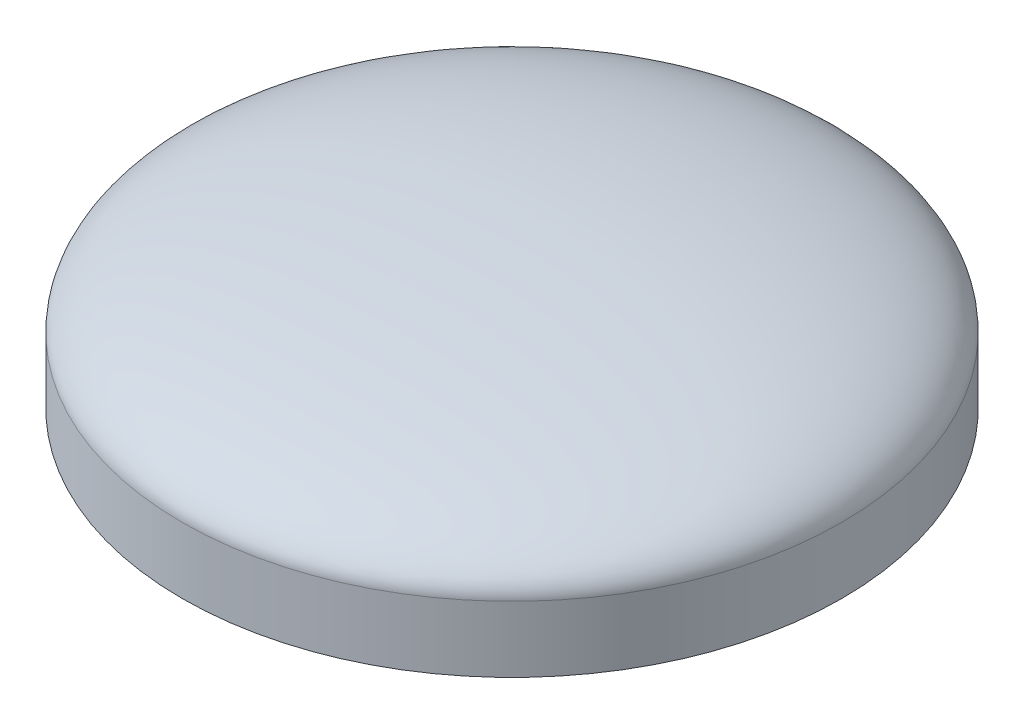
from build123d import *

# Parameters (mm, degrees)
SKETCH1_R           = 100
BOSS_EXTRUDE1_DEPTH = 20
SHELL1_T            = -2


with BuildPart() as part:
    # Sketch1 → Boss-Extrude1 (new body)
    with BuildSketch(Plane(origin=(0, 0, 0), x_dir=(1, 0, 0), z_dir=(0, 1, 0))):
        Circle(SKETCH1_R)
    extrude(amount=BOSS_EXTRUDE1_DEPTH)

    # Sketch2 → Revolve1 (revolve)
    with BuildSketch(Plane.XY):
        with BuildLine():
            Line((0, 20), (0, 45))
            add(Edge.make_bspline(
                [(0, 45), (-100, 45), (-100, 20)],
                knots=[4.71238898, 4.71238898, 4.71238898, 6.283185307, 6.283185307, 6.283185307], degree=2, weights=[1, 0.707106781, 1]))
            Line((-100, 20), (0, 20))
        make_face()
    revolve(axis=Axis((0, 20, 0), (0, 1, 0)))

    # Shell1
    shell1_openings = [part.faces().sort_by_distance(p)[0] for p in [
        (0, 0, 0),
    ]]
    offset(amount=SHELL1_T, openings=shell1_openings, kind=Kind.INTERSECTION)


solid = part.part
